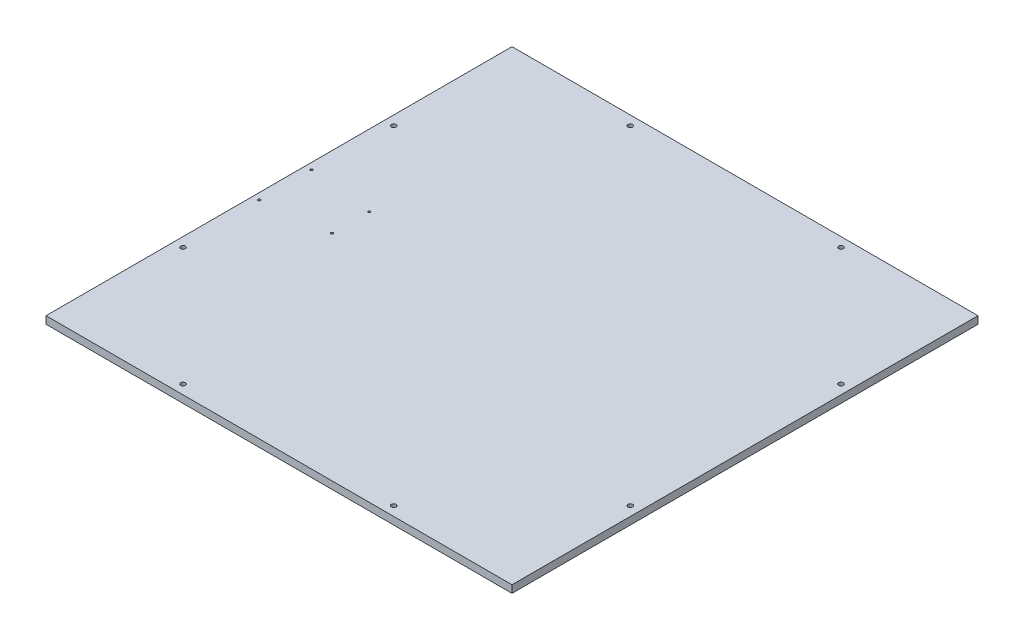
from build123d import *

# Parameters (mm, degrees)
SKETCH1_W           = 500
SKETCH1_H           = 500
BOSS_EXTRUDE1_DEPTH = 8
SKETCH6_R           = 2.5
CUT_EXTRUDE5_DEPTH  = 8
SKETCH5_R           = 1.25
CUT_EXTRUDE4_DEPTH  = 8


with BuildPart() as part:
    # Sketch1 → Boss-Extrude1 (new body)
    with BuildSketch(Plane(origin=(0, 0, 0), x_dir=(1, 0, 0), z_dir=(0, 1, 0))):
        Rectangle(SKETCH1_W, SKETCH1_H)
    extrude(amount=BOSS_EXTRUDE1_DEPTH)

    # Sketch6 → Cut-Extrude5 (cut)
    with BuildSketch(Plane(origin=(0, 8, 0), x_dir=(1, 0, 0), z_dir=(0, 1, 0))):
        with Locations(Location((-240, -113, 0), (0, 0, 270))):
            Circle(SKETCH6_R)
        with Locations(Location((-240, 113, 0), (0, 0, 270))):
            Circle(SKETCH6_R)
        with Locations(Location((-113, 240, 0), (0, 0, 270))):
            Circle(SKETCH6_R)
        with Locations(Location((113, 240, 0), (0, 0, 270))):
            Circle(SKETCH6_R)
        with Locations(Location((240, 113, 0), (0, 0, 270))):
            Circle(SKETCH6_R)
        with Locations(Location((240, -113, 0), (0, 0, 270))):
            Circle(SKETCH6_R)
        with Locations(Location((113, -240, 0), (0, 0, 270))):
            Circle(SKETCH6_R)
        with Locations(Location((-113, -240, 0), (0, 0, 270))):
            Circle(SKETCH6_R)
    extrude(amount=-CUT_EXTRUDE5_DEPTH, mode=Mode.SUBTRACT)

    # Sketch5 → Cut-Extrude4 (cut)
    with BuildSketch(Plane(origin=(0, 8, 0), x_dir=(1, 0, 0), z_dir=(0, 1, 0))):
        with Locations(Location((-243.151847812, 28, 0), (0, 0, 270))):
            Circle(SKETCH5_R)
        with Locations(Location((-173.151847812, 20, 0), (0, 0, 270))):
            Circle(SKETCH5_R)
        with Locations(Location((-173.151847812, -20, 0), (0, 0, 270))):
            Circle(SKETCH5_R)
        with Locations(Location((-243.151847812, -28, 0), (0, 0, 270))):
            Circle(SKETCH5_R)
    extrude(amount=-CUT_EXTRUDE4_DEPTH, mode=Mode.SUBTRACT)


solid = part.part
